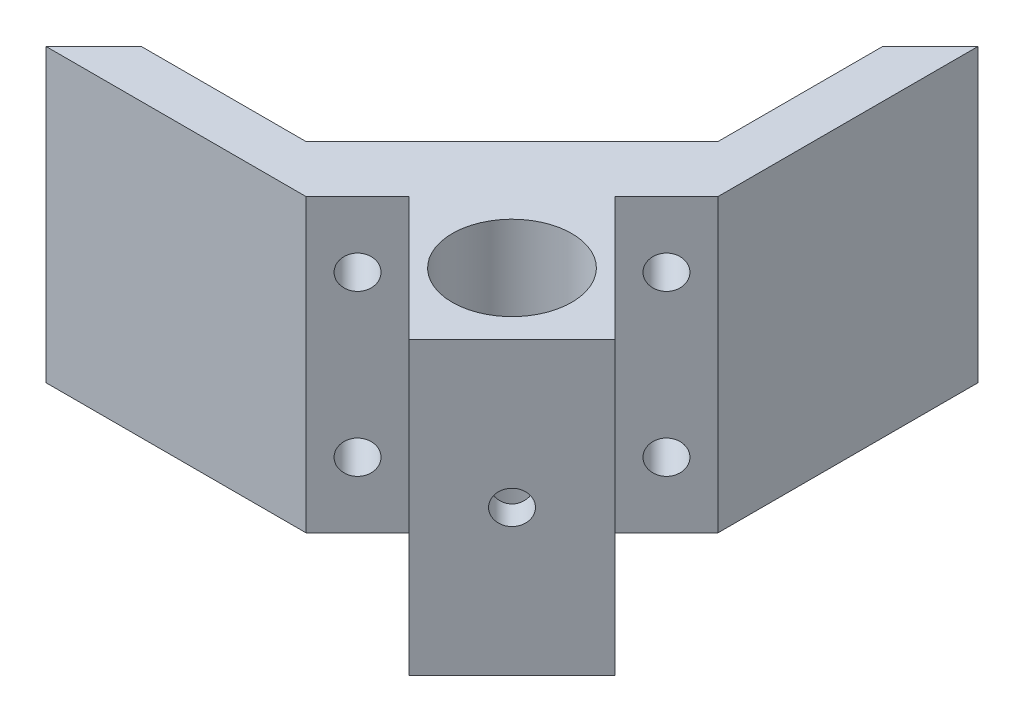
from build123d import *

# Parameters (mm, degrees)
BOSS_EXTRUDE1_DEPTH             = 50
CUT_EXTRUDE1_DEPTH              = 76.498344353
SKETCH5_W                       = 25
SKETCH5_H                       = 50
BOSS_EXTRUDE2_DEPTH             = 30
F_20_5_20_5_DIAMETER_HOLE1_D    = 20.5
F_5_7_5_7_DIAMETER_HOLE1_REACH  = 130.282
F_5_7_5_7_DIAMETER_HOLE1_BORE_R = 2.85
F_5_7_5_7_DIAMETER_HOLE2_D      = 5.7
F_5_7_5_7_DIAMETER_HOLE2_DEPTH  = 11.568542495
F_5_7_5_7_DIAMETER_HOLE2_TIP    = 1.712452764


with BuildPart() as part:
    # Sketch2 → Boss-Extrude1 (new body)
    with BuildSketch(Plane(origin=(0, 0, 0), x_dir=(1, 0, 0), z_dir=(0, 1, 0))):
        Polygon((-40, -40), (40, 40), (40, -40), align=None)
    extrude(amount=BOSS_EXTRUDE1_DEPTH)

    # Sketch4 → Cut-Extrude1 (cut, through all)
    with BuildSketch(Plane(origin=(0, 50, 0), x_dir=(1, 0, 0), z_dir=(0, 1, 0))):
        Polygon((17.67766953, 17.67766953), (-17.67766953, -17.67766953), (-3.535533906, -31.819805153), (31.819805153, 3.535533906), align=None)
        Polygon((31.819805153, 31.819805153), (17.67766953, 17.67766953), (31.819805153, 3.535533906), align=None)
        Polygon((-17.67766953, -17.67766953), (-31.819805153, -31.819805153), (-3.535533906, -31.819805153), align=None)
        Polygon((40, -4.644660941), (4.644660941, -40), (40, -40), align=None)
    extrude(amount=-CUT_EXTRUDE1_DEPTH, mode=Mode.SUBTRACT)

    # Sketch5 → Boss-Extrude2 (add)
    with BuildSketch(Plane(origin=(22.32233047, 0, 22.32233047), x_dir=(0.7071067811865474, 0, -0.7071067811865477), z_dir=(0.7071067811865477, 0, 0.7071067811865474))):
        with Locations((0, 25)):
            Rectangle(SKETCH5_W, SKETCH5_H)
    extrude(amount=BOSS_EXTRUDE2_DEPTH)

    # Ø20.5 (20.5) Diameter Hole1 (through all)
    with Locations(Plane(origin=(0, 50, 0), x_dir=(1, 0, 0), z_dir=(0, 1, 0))):
        with Locations((32.928932188, -32.928932188)):
            Hole(F_20_5_20_5_DIAMETER_HOLE1_D / 2)

    # Ø5.7 (5.7) Diameter Hole1 bore → Ø5.7 (5.7) Diameter Hole1 (cut, up to next)
    with BuildSketch(Plane(origin=(43.535533906, 0, 43.535533906), x_dir=(0.7071067811865476, 0, -0.7071067811865476), z_dir=(0.7071067811865476, 0, 0.7071067811865476)), mode=Mode.PRIVATE) as f_5_7_5_7_diameter_hole1_sk1:
        with Locations((0, 25)):
            Circle(F_5_7_5_7_DIAMETER_HOLE1_BORE_R)
    f_5_7_5_7_diameter_hole1_tool1 = extrude(f_5_7_5_7_diameter_hole1_sk1.sketch, amount=-F_5_7_5_7_DIAMETER_HOLE1_REACH, mode=Mode.PRIVATE) & part.part
    add(f_5_7_5_7_diameter_hole1_tool1.solids().sort_by_distance((43.535534, 25, 43.535534))[0], mode=Mode.SUBTRACT)

    # Ø5.7 (5.7) Diameter Hole2
    with Locations(Plane(origin=(22.32233047, 0, 22.32233047), x_dir=(0.7071067811865474, 0, -0.7071067811865477), z_dir=(0.7071067811865477, 0, 0.7071067811865474))):
        with Locations((-18.75, 38.75), (18.75, 38.75), (18.75, 11.25), (-18.75, 11.25)):
            Hole(F_5_7_5_7_DIAMETER_HOLE2_D / 2, depth=F_5_7_5_7_DIAMETER_HOLE2_DEPTH)
            with Locations((0, 0, -(F_5_7_5_7_DIAMETER_HOLE2_DEPTH + F_5_7_5_7_DIAMETER_HOLE2_TIP / 2))):  # 118° drill point
                Cone(0, F_5_7_5_7_DIAMETER_HOLE2_D / 2, F_5_7_5_7_DIAMETER_HOLE2_TIP, mode=Mode.SUBTRACT)


solid = part.part
